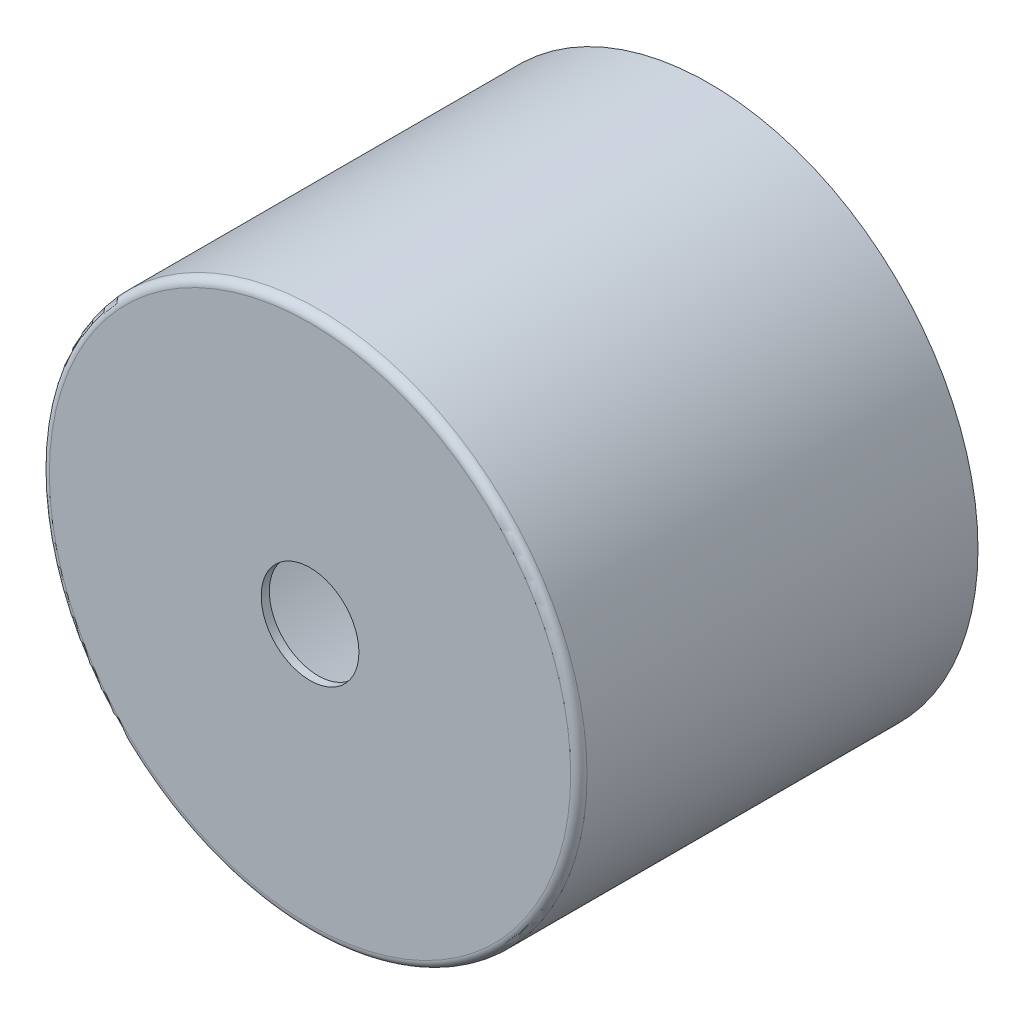
from build123d import *

# Parameters (mm, degrees)
SKETCH1_R           = 16.5
BOSS_EXTRUDE1_DEPTH = 24.5
SHELL1_T            = -0.5
SKETCH2_R           = 3
CUT_EXTRUDE1_DEPTH  = 34.834154341
FILLET1_R           = 0.5


with BuildPart() as part:
    # Sketch1 → Boss-Extrude1 (new body)
    with BuildSketch(Plane.XY):
        Circle(SKETCH1_R)
    extrude(amount=-BOSS_EXTRUDE1_DEPTH)

    # Shell1
    shell1_openings = [part.faces().sort_by_distance(p)[0] for p in [
        (0, 0, -24.5),
    ]]
    offset(amount=SHELL1_T, openings=shell1_openings, kind=Kind.INTERSECTION)

    # Sketch2 → Cut-Extrude1 (cut, through all)
    with BuildSketch(Plane.XY):
        Circle(SKETCH2_R)
    extrude(amount=-CUT_EXTRUDE1_DEPTH, mode=Mode.SUBTRACT)

    # Fillet1
    fillet1_edges = [part.edges().sort_by_distance(p)[0] for p in [
        (-16.5, 0, 0),
    ]]
    fillet(fillet1_edges, radius=FILLET1_R)


solid = part.part
